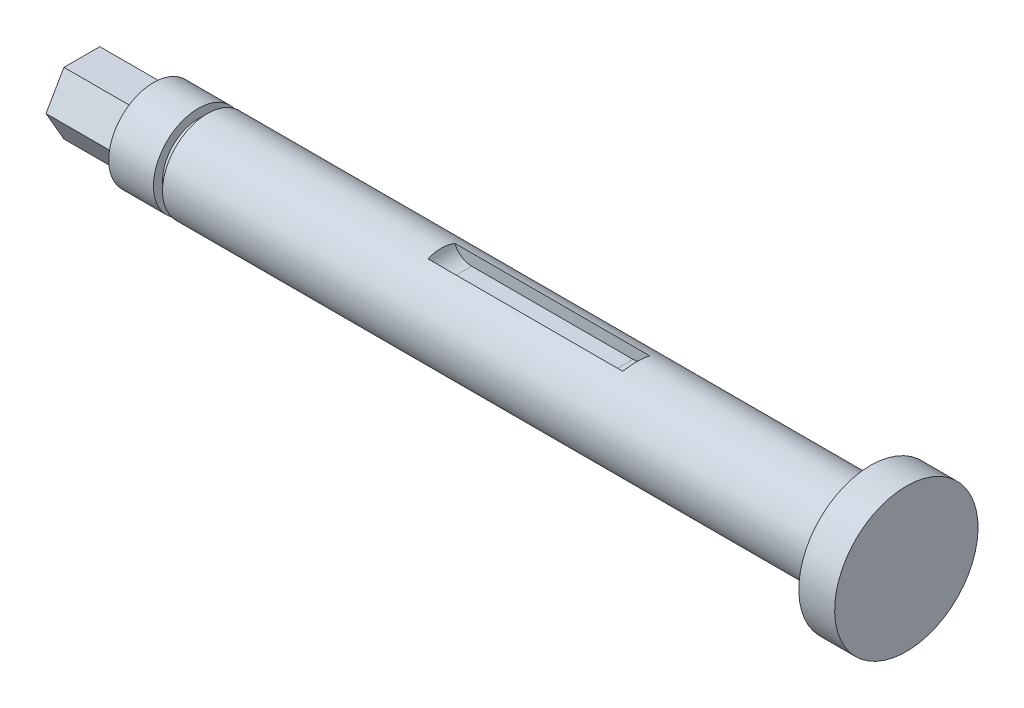
from build123d import *

# Parameters (mm, degrees)
CUT_EXTRUDE1_DEPTH = 2.38125
SKETCH3_OUTSIDE_W  = 57.48
SKETCH3_OUTSIDE_H  = 57.48
CUT_EXTRUDE2_DEPTH = 12.7


with BuildPart() as part:
    # Sketch1 → Revolve1 (revolve)
    with BuildSketch(Plane.XY):
        Polygon((-46.181818182, -7.851196491), (-46.181818182, -1.501196491), (-33.481818182, -1.501196491), (-33.481818182, 0.086303509), (-25.557018182, 0.086303509), (-25.557018182, -1.513896491), (-23.956818182, -1.513896491), (-23.956818182, 0.086303509), (93.518181818, 0.086303509), (93.518181818, 4.848803509), (99.868181818, 4.848803509), (99.868181818, -7.851196491), align=None)
    revolve(axis=Axis((-46.181818182, -7.851196491, 0), (-1, 0, 0)))

    # Sketch2 → Cut-Extrude1 (cut, symmetric)
    with BuildSketch(Plane.XY):
        with BuildLine():
            Line((17.318181818, 5.781363923), (17.318181818, 0.873703509))
            ThreePointArc((17.318181818, 0.873703509), (18.248117788, -1.371360522), (20.493181818, -2.301296491))
            Line((20.493181818, -2.301296491), (49.068181818, -2.301296491))
            ThreePointArc((49.068181818, -2.301296491), (51.313245848, -1.371360522), (52.243181818, 0.873703509))
            Line((52.243181818, 0.873703509), (52.243181818, 5.781363923))
            Line((52.243181818, 5.781363923), (17.318181818, 5.781363923))
        make_face()
    extrude(amount=CUT_EXTRUDE1_DEPTH, both=True, mode=Mode.SUBTRACT)

    # Sketch3 outside → Cut-Extrude2 (cut)
    with BuildSketch(Plane.ZY.offset(46.181818182)):
        with Locations((0, -7.851)):
            Rectangle(SKETCH3_OUTSIDE_W, SKETCH3_OUTSIDE_H)
        Polygon((6.35, -7.851196491), (3.175, -2.351935177), (-3.175, -2.351935177), (-6.35, -7.851196491), (-3.175, -13.350457805), (3.175, -13.350457805), align=None, mode=Mode.SUBTRACT)
    extrude(amount=-CUT_EXTRUDE2_DEPTH, mode=Mode.SUBTRACT)


solid = part.part
